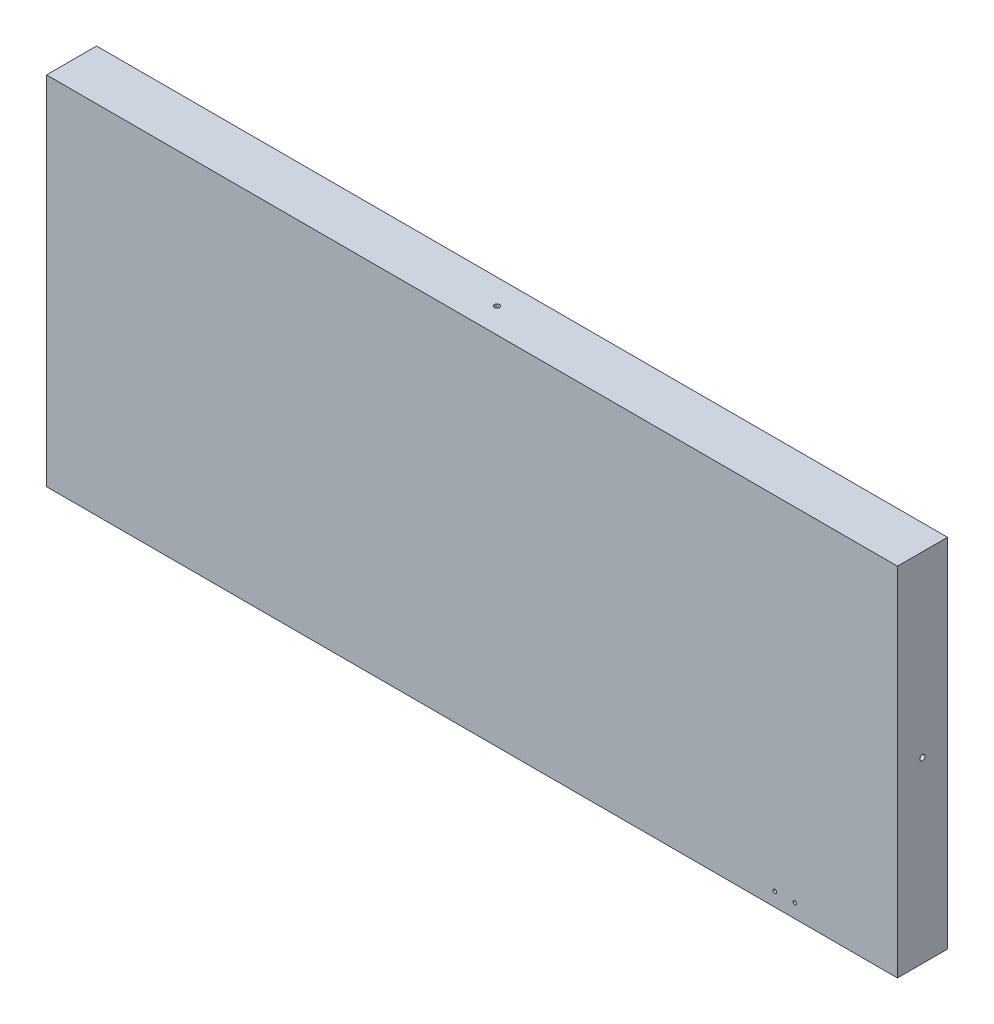
from build123d import *

# Parameters (mm, degrees)
SKETCH_1_W               = 680
SKETCH_1_H               = 285
EXTRUDE_1_DEPTH          = 40
HOLE_WIZARD_M5_1_D       = 4.2
HOLE_WIZARD_M5_2_D       = 4.2
HOLE_WIZARD_M3_5_1_D     = 2.9
HOLE_WIZARD_M3_5_1_DEPTH = 7.4
HOLE_WIZARD_M3_5_1_TIP   = 0.871247898


with BuildPart() as part:
    # 草图1 → 凸台-拉伸1 (new body)
    with BuildSketch(Plane.XY):
        Rectangle(SKETCH_1_W, SKETCH_1_H)
    extrude(amount=EXTRUDE_1_DEPTH)

    # M5 螺纹孔1 (through all)
    with Locations(Plane(origin=(0, -142.5, 0), x_dir=(-1, 0, 0), z_dir=(0, -1, 0))):
        with Locations((0, -20)):
            Hole(HOLE_WIZARD_M5_1_D / 2)

    # M5 螺纹孔2 (through all)
    with Locations(Plane.ZY.offset(340)):
        with Locations((20, 0)):
            Hole(HOLE_WIZARD_M5_2_D / 2)

    # M3.5 螺纹孔1
    with Locations(Plane.XY.offset(40)):
        with Locations((258, -131.5), (242, -131.5)):
            Hole(HOLE_WIZARD_M3_5_1_D / 2, depth=HOLE_WIZARD_M3_5_1_DEPTH)
            with Locations((0, 0, -(HOLE_WIZARD_M3_5_1_DEPTH + HOLE_WIZARD_M3_5_1_TIP / 2))):  # 118° drill point
                Cone(0, HOLE_WIZARD_M3_5_1_D / 2, HOLE_WIZARD_M3_5_1_TIP, mode=Mode.SUBTRACT)


solid = part.part
